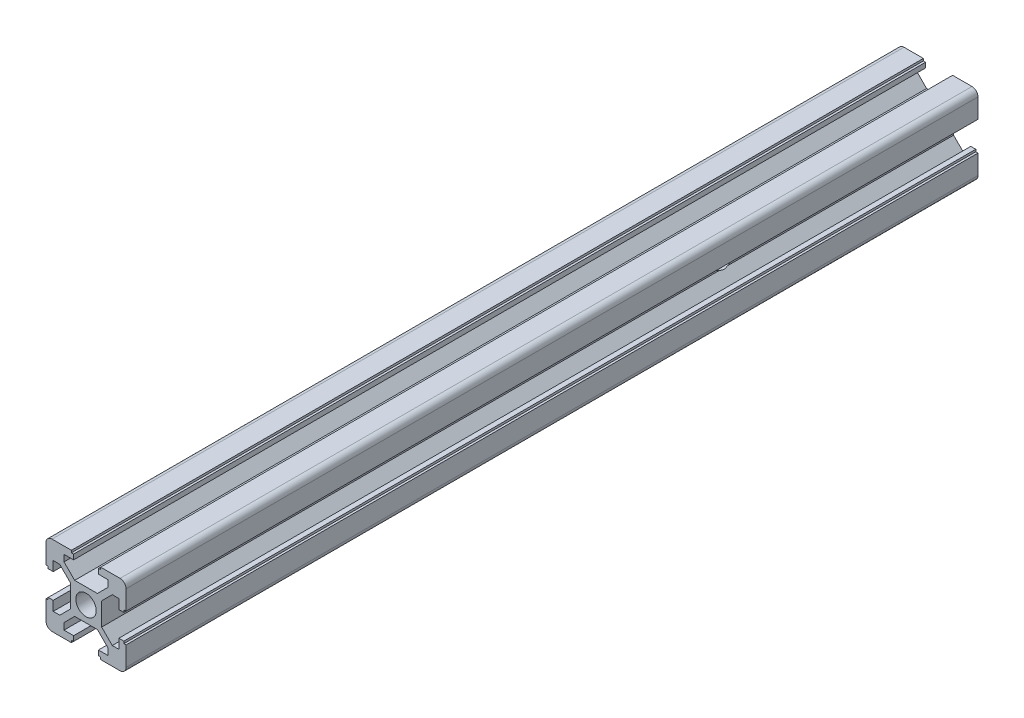
from build123d import *

# Parameters (mm, degrees)
SKETCH_2_R          = 2.55
EXTRUDE_1_DEPTH     = 212.84
SKETCH_3_R          = 3
CUT_EXTRUDE_1_DEPTH = 215.011367922


with BuildPart() as part:
    # 草图2 → 凸台-拉伸1 (new body)
    with BuildSketch(Plane.XY):
        with BuildLine():
            Line((-3.9, 2.839339828), (-6.560660172, 5.5))
            Line((-6.560660172, 5.5), (-8.2, 5.5))
            Line((-8.2, 5.5), (-8.2, 3.1))
            Line((-8.2, 3.1), (-9.45, 3.1))
            Line((-9.45, 3.1), (-9.45, 3.65))
            Line((-9.45, 3.65), (-10, 3.65))
            Line((-10, 3.65), (-10, 8.5))
            ThreePointArc((-10, 8.5), (-9.560660172, 9.560660172), (-8.5, 10))
            Line((-8.5, 10), (-3.65, 10))
            Line((-3.65, 10), (-3.65, 9.45))
            Line((-3.65, 9.45), (-3.1, 9.45))
            Line((-3.1, 9.45), (-3.1, 8.2))
            Line((-3.1, 8.2), (-5.5, 8.2))
            Line((-5.5, 8.2), (-5.5, 6.560660172))
            Line((-5.5, 6.560660172), (-2.839339828, 3.9))
            Line((-2.839339828, 3.9), (2.839339828, 3.9))
            Line((2.839339828, 3.9), (5.5, 6.560660172))
            Line((5.5, 6.560660172), (5.5, 8.2))
            Line((5.5, 8.2), (3.1, 8.2))
            Line((3.1, 8.2), (3.1, 9.45))
            Line((3.1, 9.45), (3.65, 9.45))
            Line((3.65, 9.45), (3.65, 10))
            Line((3.65, 10), (8.5, 10))
            ThreePointArc((8.5, 10), (9.560660172, 9.560660172), (10, 8.5))
            Line((10, 8.5), (10, 3.65))
            Line((10, 3.65), (9.45, 3.65))
            Line((9.45, 3.65), (9.45, 3.1))
            Line((9.45, 3.1), (8.2, 3.1))
            Line((8.2, 3.1), (8.2, 5.5))
            Line((8.2, 5.5), (6.560660172, 5.5))
            Line((6.560660172, 5.5), (3.9, 2.839339828))
            Line((3.9, 2.839339828), (3.9, -2.839339828))
            Line((3.9, -2.839339828), (6.560660172, -5.5))
            Line((6.560660172, -5.5), (8.2, -5.5))
            Line((8.2, -5.5), (8.2, -3.1))
            Line((8.2, -3.1), (9.45, -3.1))
            Line((9.45, -3.1), (9.45, -3.65))
            Line((9.45, -3.65), (10, -3.65))
            Line((10, -3.65), (10, -8.5))
            ThreePointArc((10, -8.5), (9.560660172, -9.560660172), (8.5, -10))
            Line((8.5, -10), (3.65, -10))
            Line((3.65, -10), (3.65, -9.45))
            Line((3.65, -9.45), (3.1, -9.45))
            Line((3.1, -9.45), (3.1, -8.2))
            Line((3.1, -8.2), (5.5, -8.2))
            Line((5.5, -8.2), (5.5, -6.560660172))
            Line((5.5, -6.560660172), (2.839339828, -3.9))
            Line((2.839339828, -3.9), (-2.839339828, -3.9))
            Line((-2.839339828, -3.9), (-5.5, -6.560660172))
            Line((-5.5, -6.560660172), (-5.5, -8.2))
            Line((-5.5, -8.2), (-3.1, -8.2))
            Line((-3.1, -8.2), (-3.1, -9.45))
            Line((-3.1, -9.45), (-3.65, -9.45))
            Line((-3.65, -9.45), (-3.65, -10))
            Line((-3.65, -10), (-8.5, -10))
            ThreePointArc((-8.5, -10), (-9.560660172, -9.560660172), (-10, -8.5))
            Line((-10, -8.5), (-10, -3.65))
            Line((-10, -3.65), (-9.45, -3.65))
            Line((-9.45, -3.65), (-9.45, -3.1))
            Line((-9.45, -3.1), (-8.2, -3.1))
            Line((-8.2, -3.1), (-8.2, -5.5))
            Line((-8.2, -5.5), (-6.560660172, -5.5))
            Line((-6.560660172, -5.5), (-3.9, -2.839339828))
            Line((-3.9, -2.839339828), (-3.9, 2.839339828))
        make_face()
        Circle(SKETCH_2_R, mode=Mode.SUBTRACT)
    extrude(amount=EXTRUDE_1_DEPTH)

    # 草图3 → 切除-拉伸1 (cut, through all)
    with BuildSketch(Plane(origin=(10, 0, 0), x_dir=(0, 0, -1), z_dir=(1, 0, 0))):
        with Locations(Location((-57.5, 0, 0), (0, 0, 71.16400384))):
            Circle(SKETCH_3_R)
        with Locations((-302.5, 0)):
            Circle(SKETCH_3_R)
    extrude(amount=-CUT_EXTRUDE_1_DEPTH, mode=Mode.SUBTRACT)


solid = part.part
